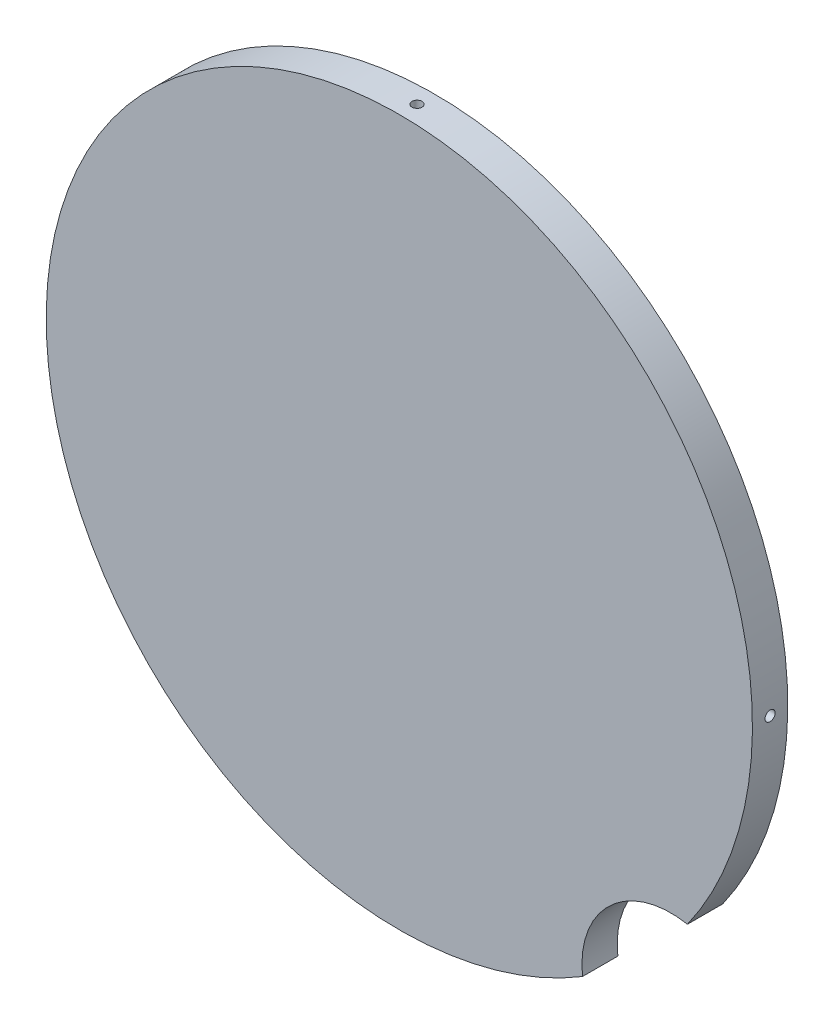
from build123d import *

# Parameters (mm, degrees)
SKETCH1_R           = 70
BOSS_EXTRUDE1_DEPTH = 7
SKETCH3_R           = 1
CUT_EXTRUDE1_DEPTH  = 12
CIRPATTERN1_COUNT   = 4
BOSS_EXTRUDE2_DEPTH = 12
SKETCH5_R           = 1.375
CUT_EXTRUDE2_DEPTH  = 12
SKETCH6_R           = 1.375
CUT_EXTRUDE3_DEPTH  = 12
CUT_EXTRUDE4_DEPTH  = 12


with BuildPart() as part:
    # Sketch1 → Boss-Extrude1 (new body)
    with BuildSketch(Plane.XY):
        Circle(SKETCH1_R)
    extrude(amount=BOSS_EXTRUDE1_DEPTH)

    # Sketch3 → Cut-Extrude1 (cut)
    with BuildSketch(Plane(origin=(0, 70, 0), x_dir=(1, 0, 0), z_dir=(0, 1, 0))):
        with Locations(Location((0, -3.5, 0), (0, 0, 270))):
            Circle(SKETCH3_R)
    cut_extrude1 = extrude(amount=-CUT_EXTRUDE1_DEPTH, mode=Mode.SUBTRACT)

    # CirPattern1: Cut-Extrude1 ×4 about axis
    cirpattern1_axis = Axis((0, 0, 0), (0, 0, 1))
    for i in range(1, CIRPATTERN1_COUNT):
        add(cut_extrude1.rotate(cirpattern1_axis, i * 360 / CIRPATTERN1_COUNT), mode=Mode.SUBTRACT)

    # Sketch4 → Boss-Extrude2 (add)
    with BuildSketch(Plane(origin=(0, 0, 0), x_dir=(-1, 0, 0), z_dir=(0, 0, -1))):
        Polygon((31.875552268, 8.541028488), (48.296291314, 12.940952255), (45.708100863, 22.600210518), (40.878471732, 21.306115293), (42.690205048, 14.544634508), (31.099095132, 11.438805967), align=None)
        Polygon((56.785555994, -18.741414847), (51.955926862, -20.035510073), (50.144193547, -13.274029289), (38.553083631, -16.37985783), (37.776626496, -13.482080351), (54.197365543, -9.082156584), align=None)
    boss_extrude2 = extrude(amount=BOSS_EXTRUDE2_DEPTH)

    # Mirror1: Boss-Extrude2 across plane
    add(boss_extrude2.mirror(Plane(origin=(0, 0, 0), x_dir=(0, 0, 1), z_dir=(1, 0, 0))))

    # Sketch5 → Cut-Extrude2 (cut)
    with BuildSketch(Plane(origin=(-48.296291314, 12.940952255, 0), x_dir=(0, 0, 1), z_dir=(-0.9659258262890689, 0.2588190451025187, 0))):
        with Locations(Location((-6.2, -25.4, 0), (0, 0, 270))):
            Circle(SKETCH5_R)
    cut_extrude2 = extrude(amount=-CUT_EXTRUDE2_DEPTH, mode=Mode.SUBTRACT)

    # Sketch6 → Cut-Extrude3 (cut)
    with BuildSketch(Plane(origin=(-48.296291314, 12.940952255, 0), x_dir=(0, 0, 1), z_dir=(-0.9659258262890691, 0.2588190451025179, 0))):
        with Locations(Location((-6.2, 2.6, 0), (0, 0, 270))):
            Circle(SKETCH6_R)
    cut_extrude3 = extrude(amount=-CUT_EXTRUDE3_DEPTH, mode=Mode.SUBTRACT)

    # Mirror2: Cut-Extrude2, Cut-Extrude3 across plane
    add(cut_extrude2.mirror(Plane(origin=(0, 0, 0), x_dir=(0, 0, 1), z_dir=(1, 0, 0))), mode=Mode.SUBTRACT)
    add(cut_extrude3.mirror(Plane(origin=(0, 0, 0), x_dir=(0, 0, 1), z_dir=(1, 0, 0))), mode=Mode.SUBTRACT)

    # Sketch7 → Cut-Extrude4 (cut)
    with BuildSketch(Plane(origin=(0, 0, 0), x_dir=(-1, 0, 0), z_dir=(0, 0, -1))):
        with BuildLine():
            ThreePointArc((-57.113972469, -40.472140403), (-41.814961007, -44.896509701), (-36.315733397, -59.842856782))
            ThreePointArc((-36.315733397, -59.842856782), (-47.708318434, -51.224177419), (-57.113972469, -40.472140403))
        make_face()
    extrude(amount=-CUT_EXTRUDE4_DEPTH, mode=Mode.SUBTRACT)


solid = part.part
